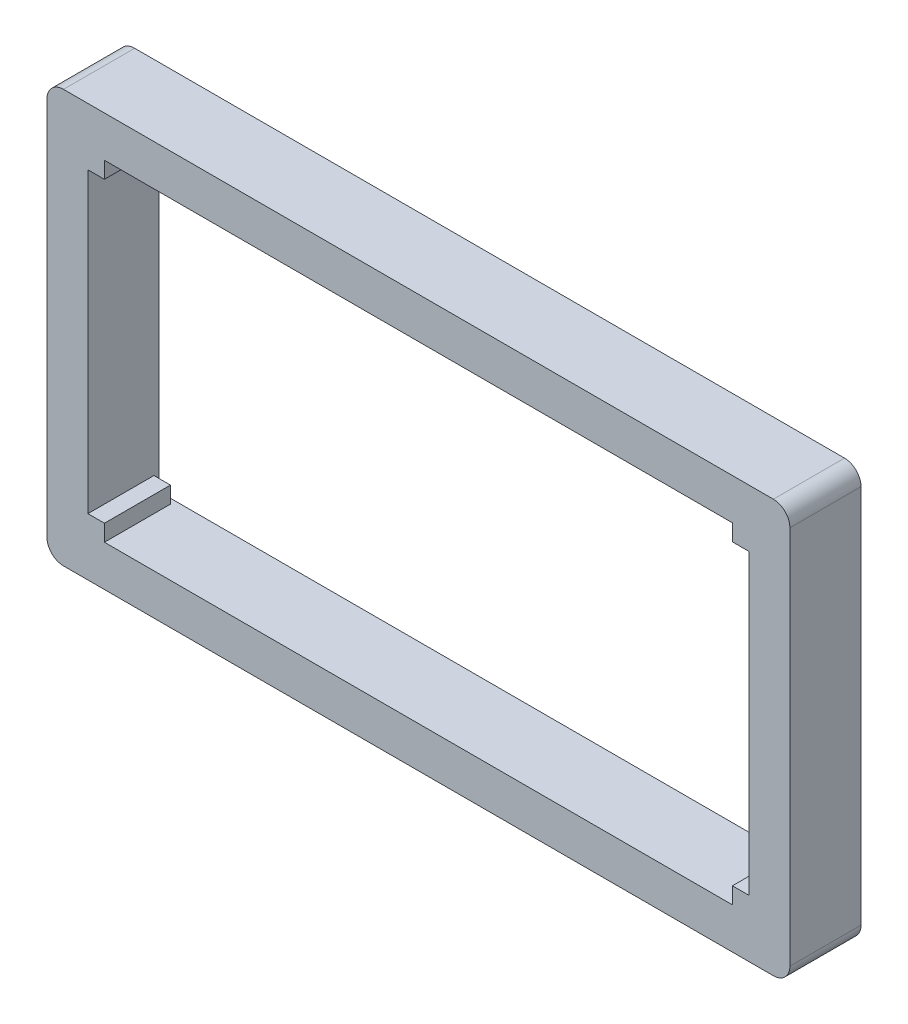
from build123d import *

# Parameters (mm, degrees)
SKETCH1_W           = 225
SKETCH1_H           = 125
SKETCH1_W_2         = 200.2
SKETCH1_H_2         = 100.2
BOSS_EXTRUDE1_DEPTH = 1.55
SKETCH2_W           = 225
SKETCH2_H           = 125
SKETCH2_W_2         = 5
SKETCH2_H_2         = 5
BOSS_EXTRUDE2_DEPTH = 20
FILLET1_R           = 5


with BuildPart() as part:
    # Sketch1 → Boss-Extrude1 (new body)
    with BuildSketch(Plane.XY):
        with Locations((100.1, 50.1)):
            Rectangle(SKETCH1_W, SKETCH1_H)
        with Locations((100.1, 50.1)):
            Rectangle(SKETCH1_W_2, SKETCH1_H_2, mode=Mode.SUBTRACT)
    extrude(amount=BOSS_EXTRUDE1_DEPTH)

    # Sketch2 → Boss-Extrude2 (add)
    # profile 1 of 5: a face of its own
    with BuildSketch(Plane.XY.offset(1.55)):
        with Locations((100.1, 50.1)):
            Rectangle(SKETCH2_W, SKETCH2_H)
        Polygon((0, 95.2), (0, 100.2), (5, 100.2), (195.2, 100.2), (200.2, 100.2), (200.2, 95.2), (200.2, 5), (200.2, 0), (195.2, 0), (5, 0), (0, 0), (0, 5), align=None, mode=Mode.SUBTRACT)
    # profile 2 of 5: a face of its own
    with BuildSketch(Plane.XY.offset(1.55)):
        with Locations((197.7, 97.7)):
            Rectangle(SKETCH2_W_2, SKETCH2_H_2)
    # profile 3 of 5: a face of its own
    with BuildSketch(Plane.XY.offset(1.55)):
        with Locations((197.7, 2.5)):
            Rectangle(SKETCH2_W_2, SKETCH2_H_2)
    # profile 4 of 5: a face of its own
    with BuildSketch(Plane.XY.offset(1.55)):
        with Locations((2.5, 2.5)):
            Rectangle(SKETCH2_W_2, SKETCH2_H_2)
    # profile 5 of 5: a face of its own
    with BuildSketch(Plane.XY.offset(1.55)):
        with Locations((2.5, 97.7)):
            Rectangle(SKETCH2_W_2, SKETCH2_H_2)
    extrude(amount=BOSS_EXTRUDE2_DEPTH)

    # Fillet1
    fillet1_edges = [part.edges().sort_by_distance(p)[0] for p in [
        (-12.4, 112.6, 10.775),
        (212.6, 112.6, 10.775),
        (212.6, -12.4, 10.775),
        (-12.4, -12.4, 10.775),
    ]]
    fillet(fillet1_edges, radius=FILLET1_R)


solid = part.part
